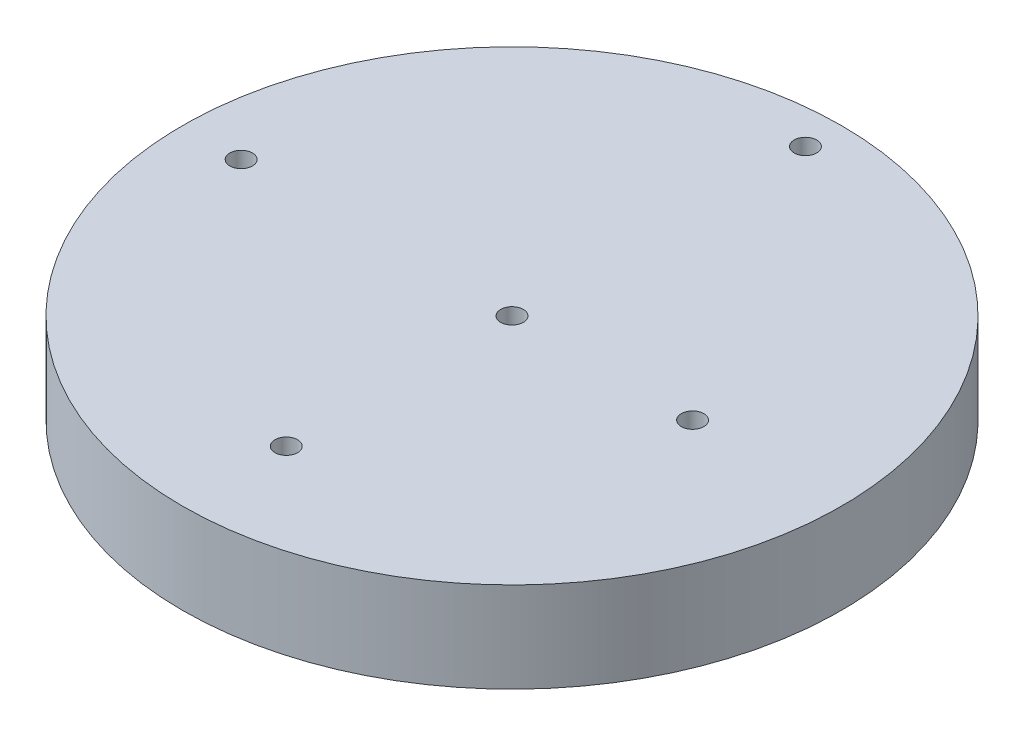
from build123d import *

# Parameters (mm, degrees)
SKETCH1_R           = 46.355
SKETCH1_R_2         = 1.5875
BOSS_EXTRUDE1_DEPTH = 12.7


with BuildPart() as part:
    # Sketch1 → Boss-Extrude1 (new body)
    with BuildSketch(Plane(origin=(0, 0, 0), x_dir=(1, 0, 0), z_dir=(0, 1, 0))):
        with Locations(Location((0, 0, 0), (0, 0, 270))):
            Circle(SKETCH1_R)
        with Locations(Location((0, 0, 0), (0, 0, 270))):
            Circle(SKETCH1_R_2, mode=Mode.SUBTRACT)
        with Locations(Location((0, 41.275, 0), (0, 0, 270))):
            Circle(SKETCH1_R_2, mode=Mode.SUBTRACT)
        with Locations(Location((25.4, 0, 0), (0, 0, 270))):
            Circle(SKETCH1_R_2, mode=Mode.SUBTRACT)
        with Locations(Location((-38.1, 0, 0), (0, 0, 270))):
            Circle(SKETCH1_R_2, mode=Mode.SUBTRACT)
        with Locations(Location((0, -31.75, 0), (0, 0, 270))):
            Circle(SKETCH1_R_2, mode=Mode.SUBTRACT)
    extrude(amount=BOSS_EXTRUDE1_DEPTH)


solid = part.part
